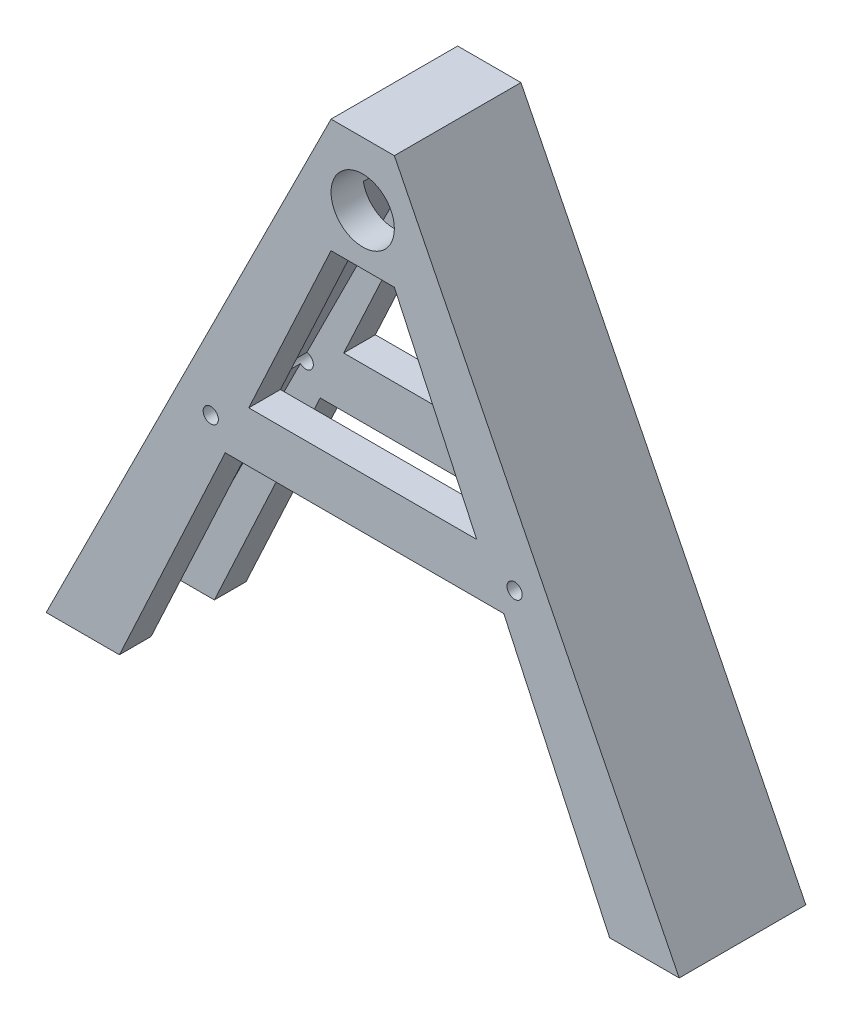
from build123d import *

# Parameters (mm, degrees)
SHELL1_T                    = -6.35
CUT_EXTRUDE1_LETTER_A_DEPTH = 134.19872387
SKETCH4_R                   = 6.35
CUT_EXTRUDE2_AXLE_DEPTH     = 134.19872387
SCALE1_SCALE                = 0.5
SKETCH5_R                   = 0.762
CUT_EXTRUDE1_DEPTH          = 67.599362011


with BuildPart() as part:
    # Sketch2 → Loft1 section 0
    with BuildSketch(Plane(origin=(0, 114.3, 0), x_dir=(1, 0, 0), z_dir=(0, 1, 0))):
        with BuildLine():
            Line((-6.35, -12.7), (6.35, -12.7))
            Line((6.35, -12.7), (6.35, 12.7))
            Line((6.35, 12.7), (-6.35, 12.7))
            Line((-6.35, 12.7), (-6.35, -12.7))
        make_face()
    # Sketch1 → Loft1 section 1
    with BuildSketch(Plane(origin=(0, 0, 0), x_dir=(1, 0, 0), z_dir=(0, 1, 0))):
        with BuildLine():
            Line((-63.5, -12.7), (63.5, -12.7))
            Line((63.5, -12.7), (63.5, 12.7))
            Line((63.5, 12.7), (-63.5, 12.7))
            Line((-63.5, 12.7), (-63.5, -12.7))
        make_face()
    loft()

    # Shell1
    shell1_openings = [part.faces().sort_by_distance(p)[0] for p in [
        (0, 0, 0),
    ]]
    offset(amount=SHELL1_T, openings=shell1_openings, kind=Kind.INTERSECTION)

    # Sketch3 → Cut-Extrude1 Letter A (cut, through all)
    with BuildSketch(Plane.XY.offset(12.7)):
        Polygon((6.35, 91.44), (22.86, 55.88), (-22.86, 55.88), (-6.35, 91.44), align=None)
        Polygon((28.302857143, 45.72), (49.53, 0), (-48.804285714, 0), (-27.577142857, 45.72), align=None)
    extrude(amount=-CUT_EXTRUDE1_LETTER_A_DEPTH, mode=Mode.SUBTRACT)

    # Sketch4 → Cut-Extrude2 Axle (cut, through all)
    with BuildSketch(Plane.XY.offset(12.7)):
        with Locations((0, 101.6)):
            Circle(SKETCH4_R)
    extrude(amount=-CUT_EXTRUDE2_AXLE_DEPTH, mode=Mode.SUBTRACT)


with BuildPart() as part_1:
    # Scale1: scaled about (0, 0, 0)
    add(part.part.scale(SCALE1_SCALE))

    # Sketch5 → Cut-Extrude1 (cut, through all)
    with BuildSketch(Plane.XY.offset(6.35)):
        with Locations((-15.24, 25.4)):
            Circle(SKETCH5_R)
        with Locations(Location((15.24, 25.4, 0), (0, 0, 90))):
            Circle(SKETCH5_R)
    extrude(amount=-CUT_EXTRUDE1_DEPTH, mode=Mode.SUBTRACT)


solid = part_1.part
